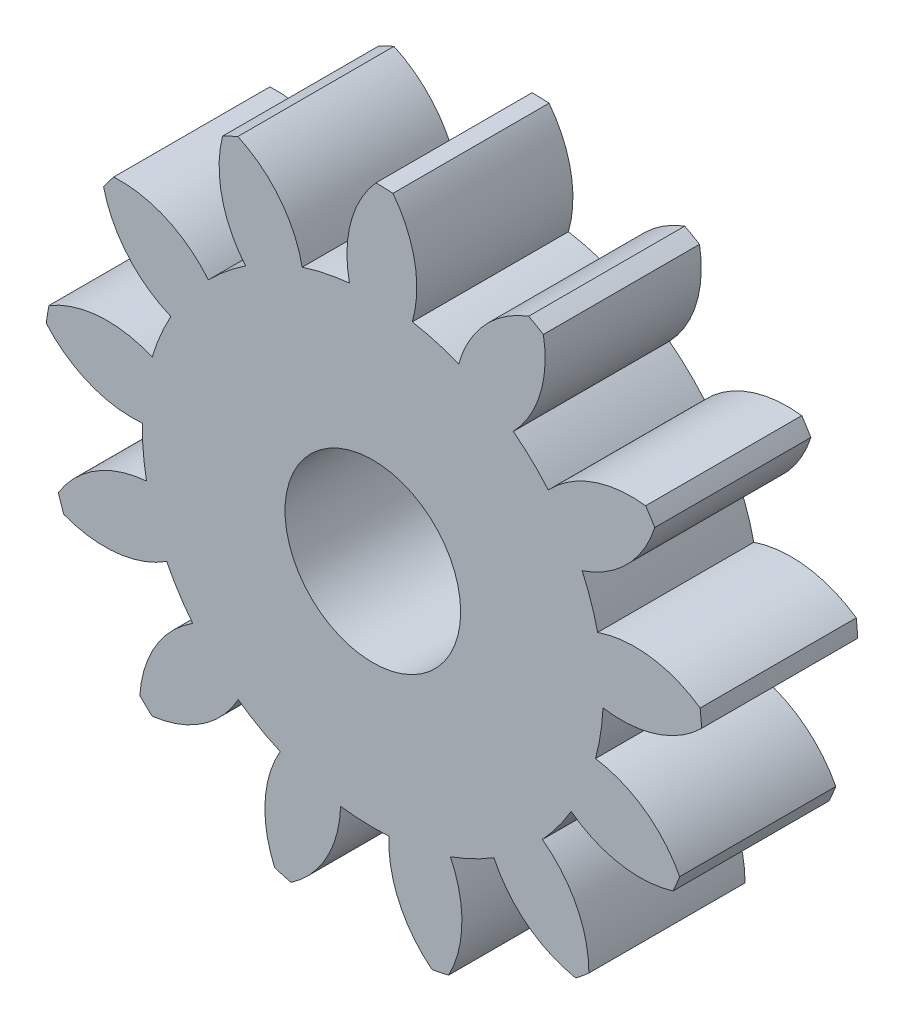
from build123d import *

# Parameters (mm, degrees)
SKETCH1_R           = 9.5
SKETCH1_R_2         = 2.25
BOSS_EXTRUDE1_DEPTH = 4
SKETCH2_R           = 9.5
CUT_EXTRUDE1_DEPTH  = 15.017845769


with BuildPart() as part:
    # Sketch1 → Boss-Extrude1 (new body)
    with BuildSketch(Plane.XY):
        Circle(SKETCH1_R)
        Circle(SKETCH1_R_2, mode=Mode.SUBTRACT)
    extrude(amount=BOSS_EXTRUDE1_DEPTH)

    # Sketch2 → Cut-Extrude1 (cut, through all)
    with BuildSketch(Plane.XY.offset(4)):
        Circle(SKETCH2_R)
        with BuildLine():
            ThreePointArc((5.362381822, 2.473224364), (6.518915118, 3.194006906), (7.223355975, 4.36056587))
            ThreePointArc((7.223355975, 4.36056587), (7.108458656, 4.54546167), (6.988829661, 4.727331828))
            ThreePointArc((6.988829661, 4.727331828), (5.634356921, 4.57733072), (4.4948488, 3.829923215))
            ThreePointArc((4.4948488, 3.829923215), (4.069180633, 4.279456337), (3.598788625, 4.681954506))
            ThreePointArc((3.598788625, 4.681954506), (4.287883651, 5.857643573), (4.369508071, 7.217950226))
            ThreePointArc((4.369508071, 7.217950226), (4.181846184, 7.32827188), (3.991400694, 7.433715542))
            ThreePointArc((3.991400694, 7.433715542), (2.861783635, 6.671441288), (2.200136889, 5.48008898))
            ThreePointArc((2.200136889, 5.48008898), (1.614317987, 5.680312931), (1.010756324, 5.818105294))
            ThreePointArc((1.010756324, 5.818105294), (1.074549714, 7.179364689), (0.514658525, 8.421789172))
            ThreePointArc((0.514658525, 8.421789172), (0.297223149, 8.432263317), (0.079589928, 8.437124611))
            ThreePointArc((0.079589928, 8.437124611), (-0.566389794, 7.237205057), (-0.598599868, 5.874832403))
            ThreePointArc((-0.598599868, 5.874832403), (-1.210365455, 5.779878288), (-1.80882807, 5.621398276))
            ThreePointArc((-1.80882807, 5.621398276), (-2.384950613, 6.856379876), (-3.458093086, 7.696297711))
            ThreePointArc((-3.458093086, 7.696297711), (-3.655490128, 7.604524849), (-3.85045393, 7.50769011))
            ThreePointArc((-3.85045393, 7.50769011), (-3.864810147, 6.145012365), (-3.26020461, 4.923722521))
            ThreePointArc((-3.26020461, 4.923722521), (-3.757768757, 4.555343184), (-4.214031752, 4.136896657))
            ThreePointArc((-4.214031752, 4.136896657), (-5.298087496, 4.962681062), (-6.638637245, 5.207677196))
            ThreePointArc((-6.638637245, 5.207677196), (-6.77077467, 5.034681382), (-6.898405196, 4.858334282))
            ThreePointArc((-6.898405196, 4.858334282), (-6.277849071, 3.645071395), (-5.174935765, 2.844647147))
            ThreePointArc((-5.174935765, 2.844647147), (-5.444312524, 2.287233855), (-5.653851544, 1.70468187))
            ThreePointArc((-5.653851544, 1.70468187), (-6.997496382, 1.932091823), (-8.298349616, 1.526040594))
            ThreePointArc((-8.298349616, 1.526040594), (-8.334956332, 1.311453085), (-8.366014967, 1.09599262))
            ThreePointArc((-8.366014967, 1.09599262), (-7.252708429, 0.310088497), (-5.904151501, 0.113897393))
            ThreePointArc((-5.904151501, 0.113897393), (-5.883629902, -0.504853187), (-5.798442084, -1.118054991))
            ThreePointArc((-5.798442084, -1.118054991), (-7.093863177, -1.541116368), (-8.057010096, -2.505193517))
            ThreePointArc((-8.057010096, -2.505193517), (-7.989699945, -2.712213309), (-7.91707153, -2.917427744))
            ThreePointArc((-7.91707153, -2.917427744), (-6.566059691, -3.095931939), (-5.280797281, -2.64294488))
            ThreePointArc((-5.280797281, -2.64294488), (-4.975078575, -3.181284447), (-4.614679421, -3.684658927))
            ThreePointArc((-4.614679421, -3.684658927), (-5.565111408, -4.661273372), (-5.969906661, -5.962517984))
            ThreePointArc((-5.969906661, -5.962517984), (-5.814099587, -6.11454432), (-5.654422416, -6.26250057))
            ThreePointArc((-5.654422416, -6.26250057), (-4.375205807, -5.792711678), (-3.447676044, -4.794320333))
            ThreePointArc((-3.447676044, -4.794320333), (-2.926796703, -5.12892178), (-2.373749315, -5.407151907))
            ThreePointArc((-2.373749315, -5.407151907), (-2.761459682, -6.713588821), (-2.515169554, -8.053901437))
            ThreePointArc((-2.515169554, -8.053901437), (-2.306559081, -8.116106915), (-2.096413271, -8.172909987))
            ThreePointArc((-2.096413271, -8.172909987), (-1.182045, -7.162450981), (-0.824733775, -5.847374775))
            ThreePointArc((-0.824733775, -5.847374775), (-0.208020978, -5.901584943), (0.410978151, -5.89093155))
            ThreePointArc((0.410978151, -5.89093155), (0.674809178, -7.227901978), (1.515762586, -8.300233131))
            ThreePointArc((1.515762586, -8.300233131), (1.729386313, -8.258367225), (1.941858891, -8.21100422))
            ThreePointArc((1.941858891, -8.21100422), (2.281908072, -6.891359081), (1.987145063, -5.560866125))
            ThreePointArc((1.987145063, -5.560866125), (2.558409847, -5.322266117), (3.101555477, -5.025169767))
            ThreePointArc((3.101555477, -5.025169767), (3.956487387, -6.086389898), (5.199451785, -6.645081443))
            ThreePointArc((5.199451785, -6.645081443), (5.369150144, -6.508735129), (5.535274583, -6.368056339))
            ThreePointArc((5.535274583, -6.368056339), (5.223103504, -5.041539866), (4.343792915, -4.000430061))
            ThreePointArc((4.343792915, -4.000430061), (4.738739807, -3.523680264), (5.08160382, -3.008202151))
            ThreePointArc((5.08160382, -3.008202151), (6.331782017, -3.550559241), (7.69200924, -3.467621679))
            ThreePointArc((7.69200924, -3.467621679), (7.778906383, -3.268030253), (7.860625575, -3.066263495))
            ThreePointArc((7.860625575, -3.066263495), (6.967748869, -2.036764624), (5.705330158, -1.523543681))
            ThreePointArc((5.705330158, -1.523543681), (5.833481586, -0.917861728), (5.897517968, -0.302091675))
            ThreePointArc((5.897517968, -0.302091675), (7.256541693, -0.201338251), (8.422420077, 0.504228423))
            ThreePointArc((8.422420077, 0.504228423), (8.406608915, 0.72134097), (8.385201978, 0.937973363))
            ThreePointArc((8.385201978, 0.937973363), (7.116166938, 1.434608847), (5.759845019, 1.302368196))
            ThreePointArc((5.759845019, 1.302368196), (5.591843034, 1.898227869), (5.362381822, 2.473224364))
        make_face(mode=Mode.SUBTRACT)
    extrude(amount=-CUT_EXTRUDE1_DEPTH, mode=Mode.SUBTRACT)


solid = part.part
